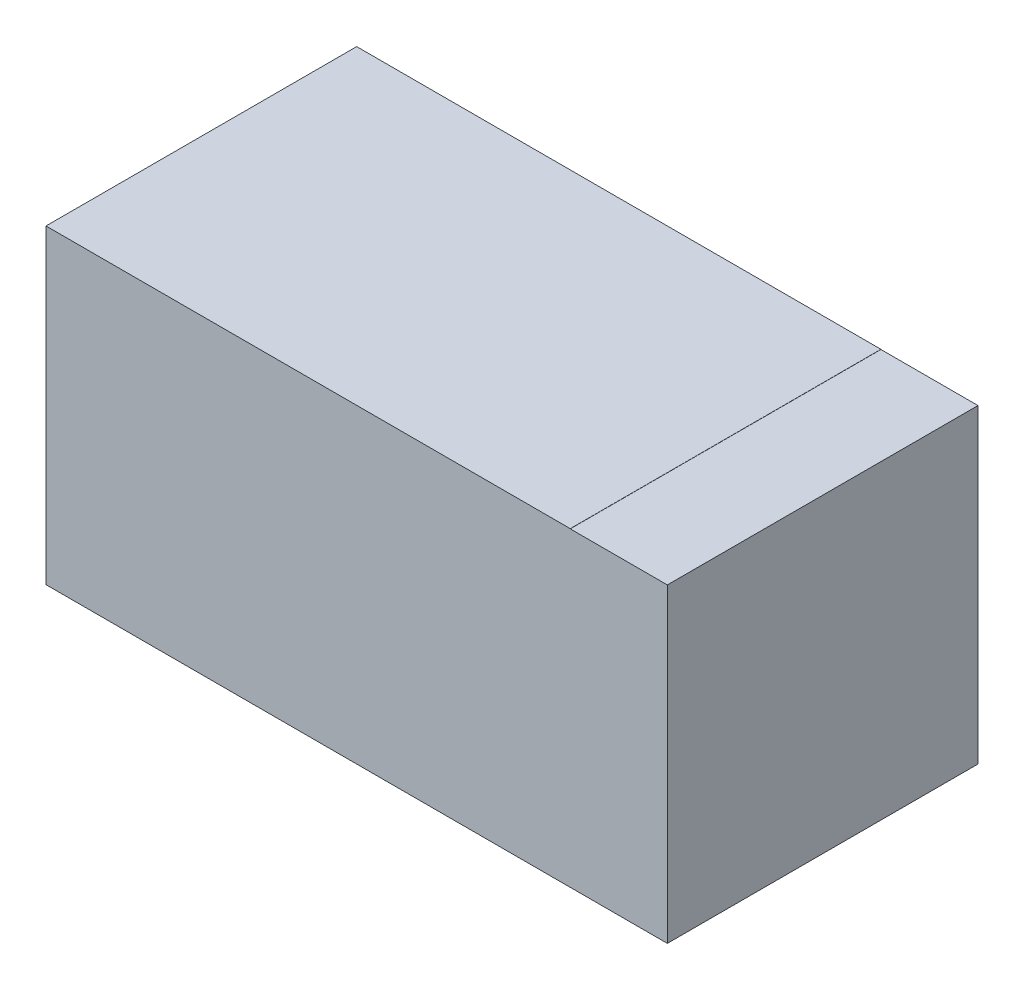
from build123d import *

# Parameters (mm, degrees)
SKETCH1_W           = 3.2
SKETCH1_H           = 1.6
BOSS_EXTRUDE1_DEPTH = 1.6
SKETCH2_W           = 0.5
SKETCH2_H           = 1.6
CUT_EXTRUDE1_DEPTH  = 0.001


with BuildPart() as part:
    # Sketch1 → Boss-Extrude1 (new body)
    with BuildSketch(Plane(origin=(0, 0, 0), x_dir=(1, 0, 0), z_dir=(0, 1, 0))):
        Rectangle(SKETCH1_W, SKETCH1_H)
    extrude(amount=BOSS_EXTRUDE1_DEPTH)

    # Sketch2 → Cut-Extrude1 (cut)
    with BuildSketch(Plane(origin=(0, 1.6, 0), x_dir=(1, 0, 0), z_dir=(0, 1, 0))):
        with Locations((1.35, 0)):
            Rectangle(SKETCH2_W, SKETCH2_H)
    extrude(amount=-CUT_EXTRUDE1_DEPTH, mode=Mode.SUBTRACT)


solid = part.part
